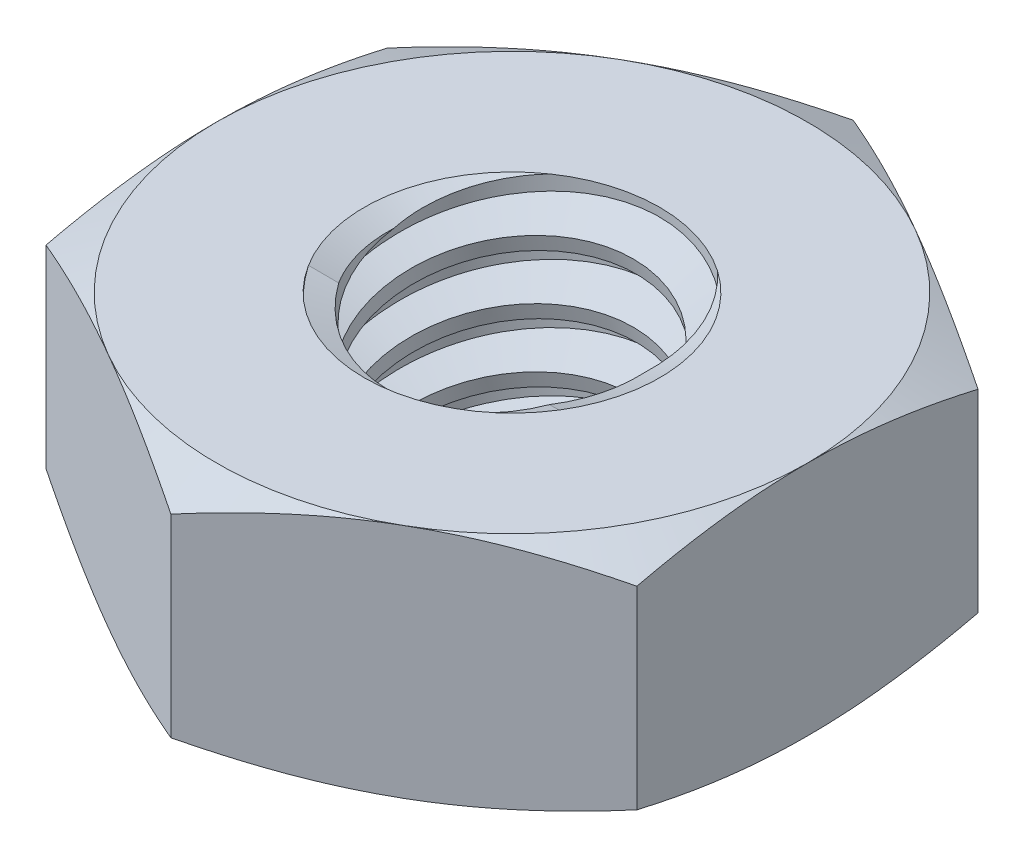
from build123d import *

# Parameters (mm, degrees)
EXTRUDE1_DEPTH      = 0.8
SKETCH2_W           = 1
SKETCH2_H           = 1.6
LPATTERN1_COUNT     = 4
LPATTERN1_PITCH     = 0.4
LPATTERN1_COL_COUNT = 2
LPATTERN1_COL_PITCH = 0.4


with BuildPart() as part:
    # Sketch1 → Extrude1 (new, symmetric)
    with BuildSketch(Plane(origin=(0, 0, 0), x_dir=(1, 0, 0), z_dir=(0, 1, 0))):
        Polygon((0, 2.309401077), (-2, 1.154700538), (-2, -1.154700538), (0, -2.309401077), (2, -1.154700538), (2, 1.154700538), align=None)
    extrude(amount=EXTRUDE1_DEPTH, both=True)

    # Sketch4 → Cut-Revolve2 (revolve, cut)
    with BuildSketch(Plane(origin=(0, 0, 0), x_dir=(0, 0, -1), z_dir=(1, 0, 0))):
        Polygon((0, 0.8), (1, 0.8), (0.82201838, 0.717005807), (0.82201838, -0.717005807), (1, -0.8), (0, -0.8), align=None)
    revolve(axis=Axis((0, 0.8, 0), (0, 1, 0)), mode=Mode.SUBTRACT)


with BuildPart() as body_2:
    # Sketch2 → Revolve1 (revolve)
    with BuildSketch(Plane(origin=(0, 0, 0), x_dir=(0, 0, -1), z_dir=(1, 0, 0))):
        with Locations((0.5, 0)):
            Rectangle(SKETCH2_W, SKETCH2_H)
    revolve(axis=Axis((0, -1.8, 0), (0, 1, 0)))

    # Sketch3 → Cut-Revolve1 (revolve, cut)
    with BuildSketch(Plane(origin=(0, 0, 0), x_dir=(0, 0, -1), z_dir=(1, 0, 0)), mode=Mode.PRIVATE) as cut_revolve1_sk:
        Polygon((1.009805807, 0.750970966), (1.078446454, 0.40776773), (0.841629993, 0.487879925), (0.82201838, 0.585937993), align=None)
    cut_revolve1 = revolve(cut_revolve1_sk.sketch.rotate(Axis((0, 0.8, 0.085891176), (0, -0.9805806756909201, -0.19611613513818438)), 180), axis=Axis((0, 0.8, 0.085891176), (0, -0.9805806756909201, -0.19611613513818438)), mode=Mode.SUBTRACT)

    # LPattern1: Cut-Revolve1 ×4
    with Locations(*[(0, -i * LPATTERN1_PITCH, 0) for i in range(1, LPATTERN1_COUNT)]):
        add(cut_revolve1, mode=Mode.SUBTRACT)

    # LPattern1 col: Cut-Revolve1 ×2
    with Locations(*[(0, i * LPATTERN1_COL_PITCH, 0) for i in range(1, LPATTERN1_COL_COUNT)]):
        add(cut_revolve1, mode=Mode.SUBTRACT)


with BuildPart() as part_1:
    add(part.part)

    # Combine1: cut body 2
    add(body_2.part, mode=Mode.SUBTRACT)

    # Sketch5 → Cut-Revolve3 (revolve, cut)
    with BuildSketch(Plane(origin=(0, 0, 0), x_dir=(0, 0, -1), z_dir=(1, 0, 0)), mode=Mode.PRIVATE) as cut_revolve3_sk:
        Polygon((0, -0.8), (2, -0.8), (2.309401077, -0.655723908), (2.309401077, 0.655723908), (2, 0.8), (0, 0.8), (0, 2.07), (3.579401077, 2.07), (3.579401077, -2.07), (0, -2.07), align=None)
    revolve(cut_revolve3_sk.sketch.rotate(Axis((0, -0.8, 0), (0, 1, 0)), 54.619043446), axis=Axis((0, -0.8, 0), (0, 1, 0)), mode=Mode.SUBTRACT)


solid = part_1.part
